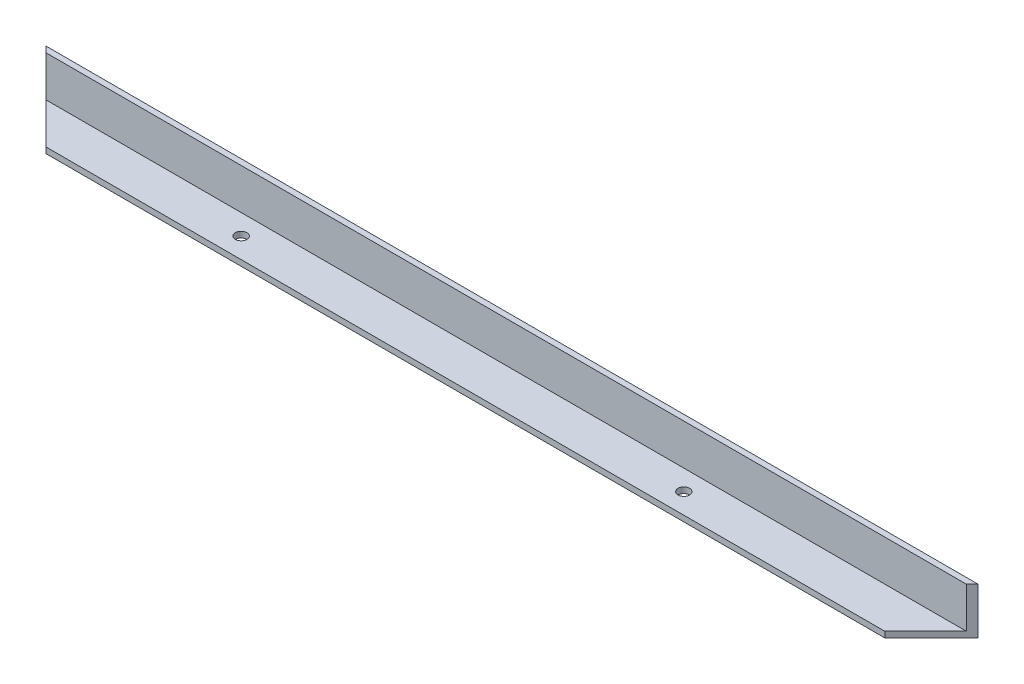
from build123d import *

# Parameters (mm, degrees)
SKETCH1_W           = 508
SKETCH1_H           = 25.4
BOSS_EXTRUDE1_DEPTH = 3.175
SKETCH2_W           = 508
SKETCH2_H           = 3.175
BOSS_EXTRUDE2_DEPTH = 22.225
CUT_EXTRUDE4_REACH  = 511.268
SKETCH6_R           = 3.175
CUT_EXTRUDE5_DEPTH  = 3.175
CUT_EXTRUDE6_REACH  = 511.268


with BuildPart() as part:
    # Sketch1 → Boss-Extrude1 (new body)
    with BuildSketch(Plane(origin=(0, 0, 0), x_dir=(1, 0, 0), z_dir=(0, 1, 0))):
        with Locations((-254, -12.7)):
            Rectangle(SKETCH1_W, SKETCH1_H)
    extrude(amount=BOSS_EXTRUDE1_DEPTH)

    # Sketch2 → Boss-Extrude2 (add)
    with BuildSketch(Plane(origin=(0, 3.175, 0), x_dir=(1, 0, 0), z_dir=(0, 1, 0))):
        with Locations((-254, -1.5875)):
            Rectangle(SKETCH2_W, SKETCH2_H)
    extrude(amount=BOSS_EXTRUDE2_DEPTH)

    # Cut-Extrude4: up to this face of the body (flat: up to its plane)
    cut_extrude4_end = Plane(part.part.faces().sort_by_distance((-254, 0, 12.7))[0])
    # Sketch3 → Cut-Extrude4 (cut, up to the picked face)
    with BuildSketch(Plane(origin=(0, 25.4, 0), x_dir=(1, 0, 0), z_dir=(0, 1, 0)), mode=Mode.PRIVATE) as cut_extrude4_sk1:
        Polygon((0, 0), (-52.33160776, -52.33160776), (49.536132654, -29.784007044), align=None)
    cut_extrude4_tool1 = split(extrude(cut_extrude4_sk1.sketch, amount=-CUT_EXTRUDE4_REACH, mode=Mode.PRIVATE), bisect_by=cut_extrude4_end, keep=Keep.BOTH, mode=Mode.PRIVATE)
    add(cut_extrude4_tool1.solids().sort_by(Axis((-0.931825, 25.4, 27.371872), (0, -1, 0)))[0], mode=Mode.SUBTRACT)

    # Sketch6 → Cut-Extrude5 (cut)
    with BuildSketch(Plane(origin=(0, 3.175, 0), x_dir=(1, 0, 0), z_dir=(0, 1, 0))):
        with Locations(Location((-146.05, -14.2875, 0), (0, 0, 270))):
            Circle(SKETCH6_R)
        with Locations(Location((-387.35, -14.2875, 0), (0, 0, 90))):
            Circle(SKETCH6_R)
    extrude(amount=-CUT_EXTRUDE5_DEPTH, mode=Mode.SUBTRACT)

    # Cut-Extrude6: up to this face of the body (flat: up to its plane)
    cut_extrude6_end = Plane(part.part.faces().sort_by_distance((-260.263320365, 0, 12.582870859))[0])
    # Sketch7 → Cut-Extrude6 (cut, up to the picked face)
    with BuildSketch(Plane(origin=(0, 25.4, 0), x_dir=(1, 0, 0), z_dir=(0, 1, 0)), mode=Mode.PRIVATE) as cut_extrude6_sk1:
        Polygon((-508, 0), (-469.606769631, -38.393230369), (-537.121608827, -29.121608827), align=None)
    cut_extrude6_tool1 = split(extrude(cut_extrude6_sk1.sketch, amount=-CUT_EXTRUDE6_REACH, mode=Mode.PRIVATE), bisect_by=cut_extrude6_end, keep=Keep.BOTH, mode=Mode.PRIVATE)
    add(cut_extrude6_tool1.solids().sort_by(Axis((-504.909459, 25.4, 22.504946), (0, -1, 0)))[0], mode=Mode.SUBTRACT)


solid = part.part
